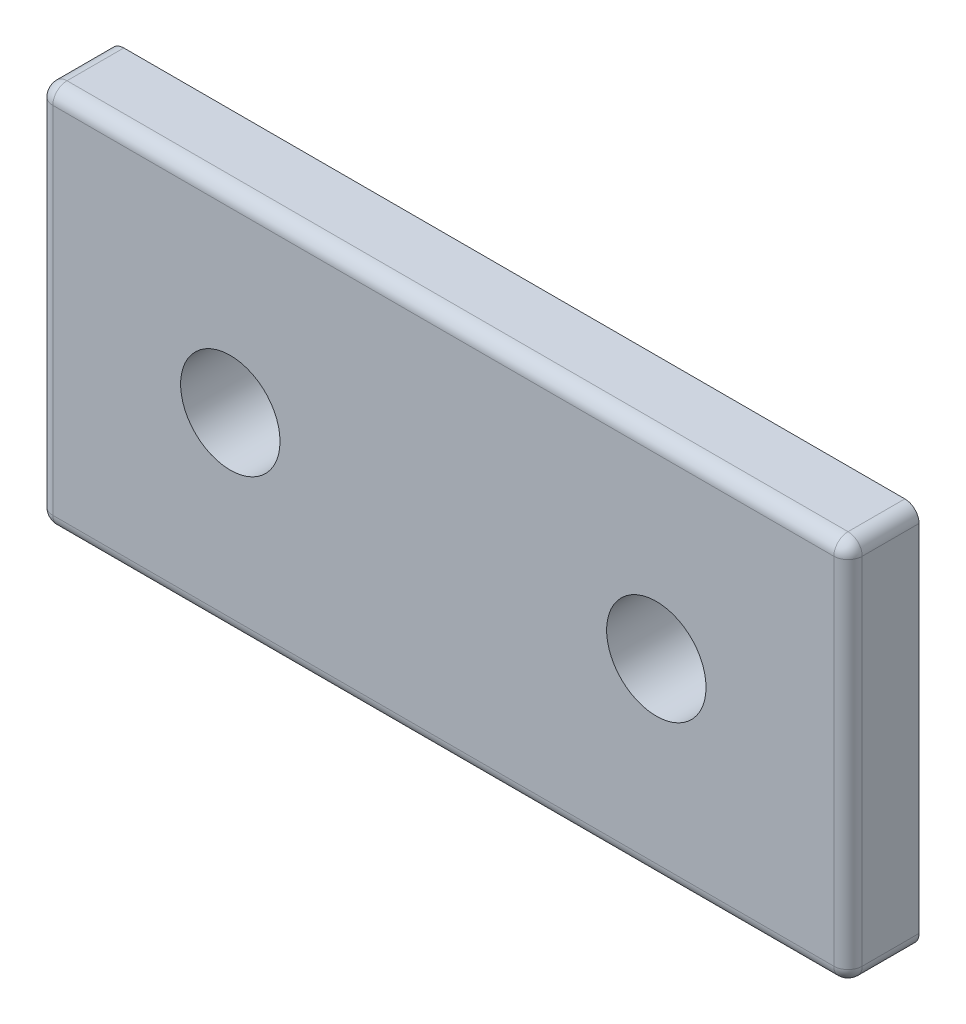
from build123d import *

# Parameters (mm, degrees)
SKETCH1_W           = 57
SKETCH1_H           = 27
SKETCH1_R           = 3.5
BOSS_EXTRUDE1_DEPTH = 2.5
FILLET1_R           = 1


with BuildPart() as part:
    # Sketch1 → Boss-Extrude1 (new, symmetric)
    with BuildSketch(Plane.XY):
        with Locations((28.5, 13.5)):
            Rectangle(SKETCH1_W, SKETCH1_H)
        with Locations((13.5, 13.5)):
            Circle(SKETCH1_R, mode=Mode.SUBTRACT)
        with Locations((43.5, 13.5)):
            Circle(SKETCH1_R, mode=Mode.SUBTRACT)
    extrude(amount=BOSS_EXTRUDE1_DEPTH, both=True)

    # Fillet1
    fillet1_edges = [part.edges().sort_by_distance(p)[0] for p in [
        (28.5, 27, 2.5),
        (0, 13.5, 2.5),
        (28.5, 0, 2.5),
        (57, 13.5, 2.5),
        (0, 0, 0),
        (0, 27, 0),
        (57, 27, 0),
        (57, 0, 0),
    ]]
    fillet(fillet1_edges, radius=FILLET1_R)


solid = part.part
